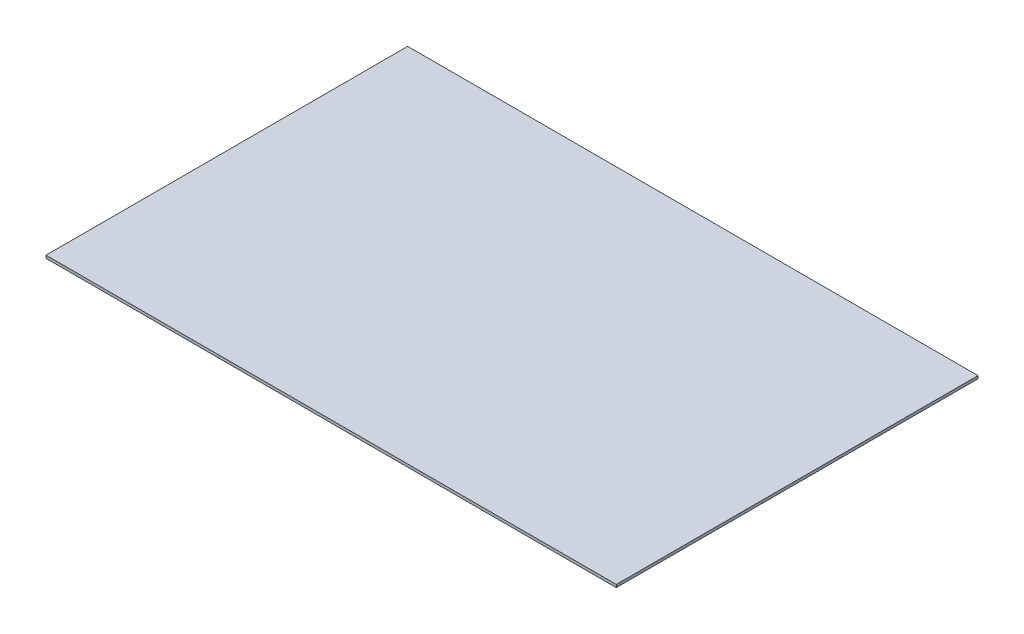
from build123d import *

# Parameters (mm, degrees)
SKETCH1_W           = 514
SKETCH1_H           = 326
BOSS_EXTRUDE1_DEPTH = 1.25


with BuildPart() as part:
    # Sketch1 → Boss-Extrude1 (new, symmetric)
    with BuildSketch(Plane(origin=(0, 0, 0), x_dir=(1, 0, 0), z_dir=(0, 1, 0))):
        Rectangle(SKETCH1_W, SKETCH1_H)
    extrude(amount=BOSS_EXTRUDE1_DEPTH, both=True)


solid = part.part
